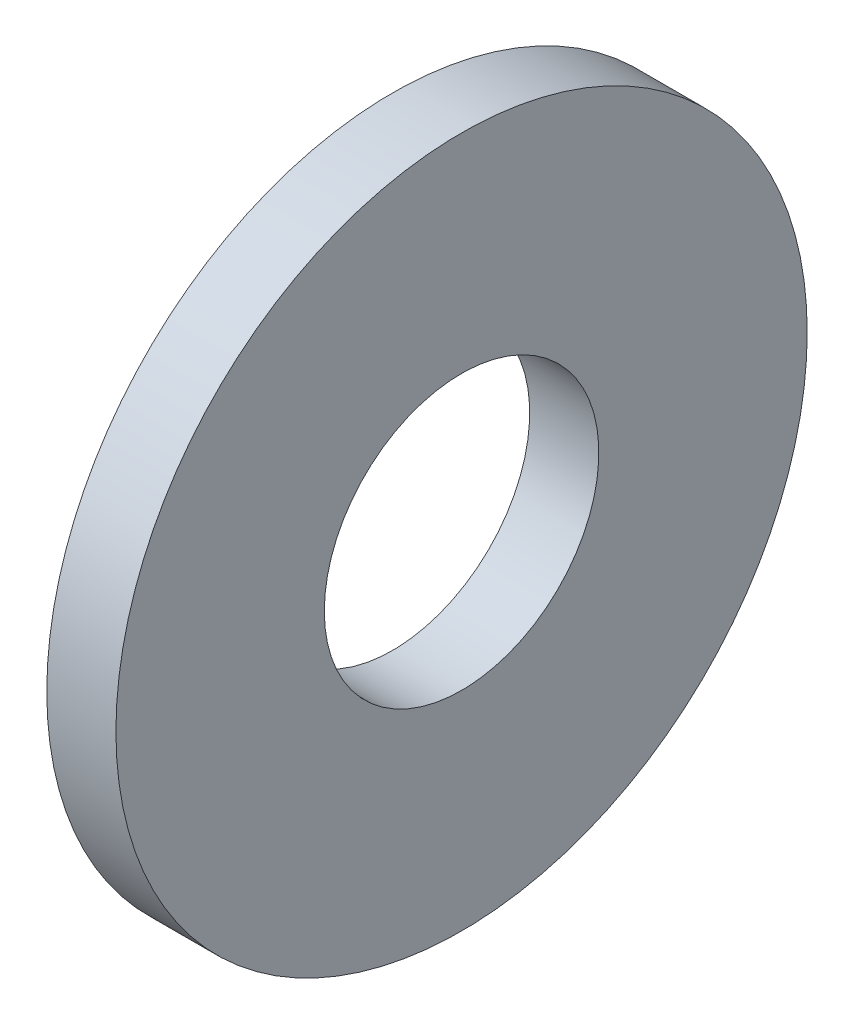
from build123d import *

# Parameters (mm, degrees)
SKETCH1_W = 2.8
SKETCH1_H = 8.44


with BuildPart() as part:
    # Sketch1 → Base-Revolve (revolve)
    with BuildSketch(Plane.XY, mode=Mode.PRIVATE) as base_revolve_sk:
        with Locations((-1.4, 9.78)):
            Rectangle(SKETCH1_W, SKETCH1_H)
    revolve(base_revolve_sk.sketch.rotate(Axis((-34.925, 0, 0), (1, 0, 0)), 90), axis=Axis((-34.925, 0, 0), (1, 0, 0)))


solid = part.part
